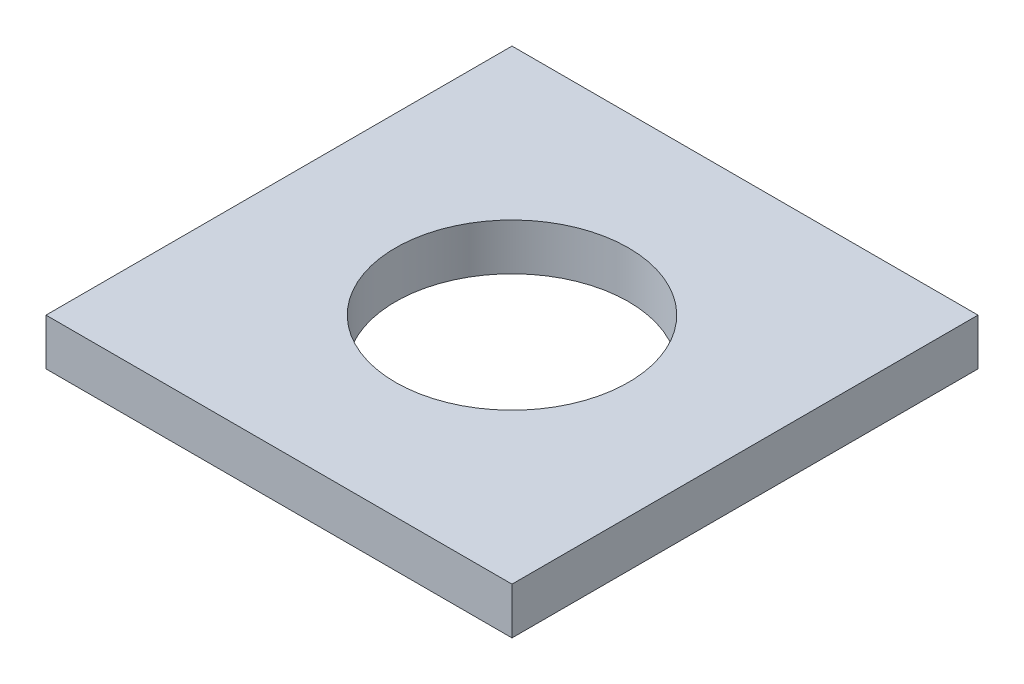
from build123d import *

# Parameters (mm, degrees)
SKETCH1_W           = 8
SKETCH1_H           = 8
SKETCH1_R           = 2
BOSS_EXTRUDE1_DEPTH = 0.8


with BuildPart() as part:
    # Sketch1 → Boss-Extrude1 (new body)
    with BuildSketch(Plane(origin=(0, 0, 0), x_dir=(1, 0, 0), z_dir=(0, 1, 0))):
        Rectangle(SKETCH1_W, SKETCH1_H)
        with Locations(Location((0, 0, 0), (0, 0, 270))):
            Circle(SKETCH1_R, mode=Mode.SUBTRACT)
    extrude(amount=BOSS_EXTRUDE1_DEPTH)


solid = part.part
